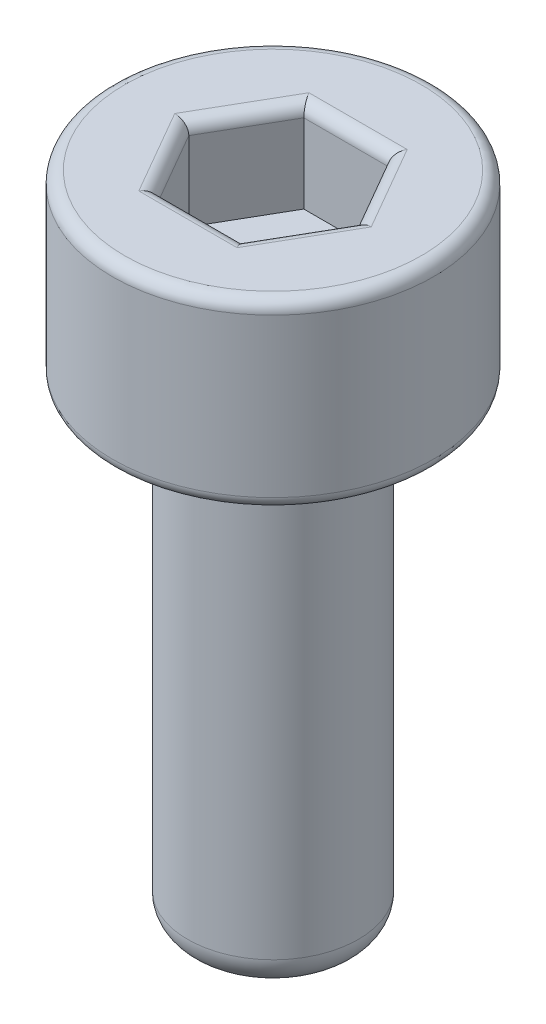
from build123d import *

# Parameters (mm, degrees)
SKETCH1_R           = 2.64
BOSS_EXTRUDE1_DEPTH = 3
SKETCH2_R           = 1.405
BOSS_EXTRUDE2_DEPTH = 7.76
FILLET1_R           = 0.2
CUT_EXTRUDE1_DEPTH  = 1.5
FILLET2_R           = 0.2
FILLET3_R           = 0.5


with BuildPart() as part:
    # Sketch1 → Boss-Extrude1 (new body)
    with BuildSketch(Plane(origin=(0, 0, 0), x_dir=(1, 0, 0), z_dir=(0, 1, 0))):
        with Locations(Location((0, 0, 0), (0, 0, 270))):
            Circle(SKETCH1_R)
    extrude(amount=BOSS_EXTRUDE1_DEPTH)

    # Sketch2 → Boss-Extrude2 (add)
    with BuildSketch(Plane.XZ):
        with Locations(Location((0, 0, 0), (0, 0, 270))):
            Circle(SKETCH2_R)
    extrude(amount=BOSS_EXTRUDE2_DEPTH)

    # Fillet1
    fillet1_edges = [part.edges().sort_by_distance(p)[0] for p in [
        (0, 0, -2.64),
        (0, 3, -2.64),
    ]]
    fillet(fillet1_edges, radius=FILLET1_R)

    # Sketch3 → Cut-Extrude1 (cut)
    with BuildSketch(Plane(origin=(0, 3, 0), x_dir=(1, 0, 0), z_dir=(0, 1, 0))):
        Polygon((1.385640646, 0), (0.692820323, 1.2), (-0.692820323, 1.2), (-1.385640646, 0), (-0.692820323, -1.2), (0.692820323, -1.2), align=None)
    extrude(amount=-CUT_EXTRUDE1_DEPTH, mode=Mode.SUBTRACT)

    # Fillet2
    fillet2_edges = [part.edges().sort_by_distance(p)[0] for p in [
        (1.039230485, 3, 0.6),
        (1.039230485, 3, -0.6),
        (0, 3, -1.2),
        (-1.039230485, 3, -0.6),
        (-1.039230485, 3, 0.6),
        (0, 3, 1.2),
    ]]
    fillet(fillet2_edges, radius=FILLET2_R)

    # Fillet3
    fillet3_edges = [part.edges().sort_by_distance(p)[0] for p in [
        (0, -7.76, 1.405),
    ]]
    fillet(fillet3_edges, radius=FILLET3_R)


solid = part.part
